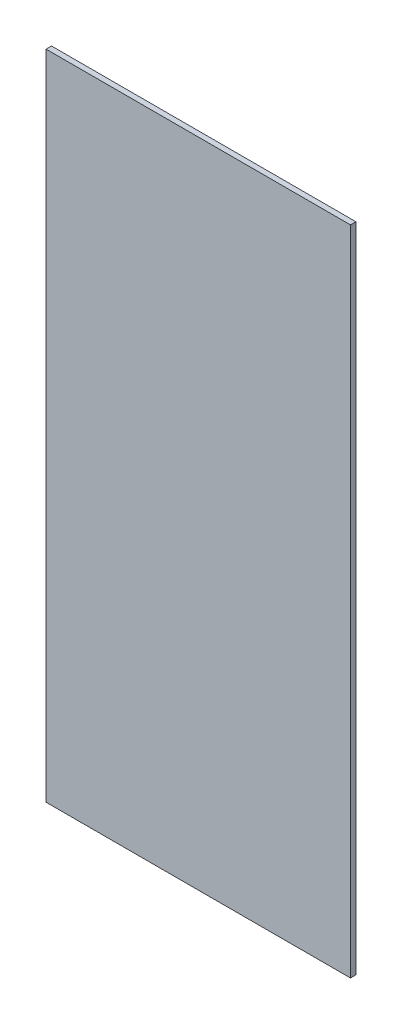
from build123d import *

# Parameters (mm, degrees)
SKETCH2_W           = 177.8
SKETCH2_H           = 381
BOSS_EXTRUDE1_DEPTH = 3.175


with BuildPart() as part:
    # Sketch2 → Boss-Extrude1 (new body)
    with BuildSketch(Plane.XY):
        with Locations((88.9, 190.5)):
            Rectangle(SKETCH2_W, SKETCH2_H)
    extrude(amount=BOSS_EXTRUDE1_DEPTH)


solid = part.part
